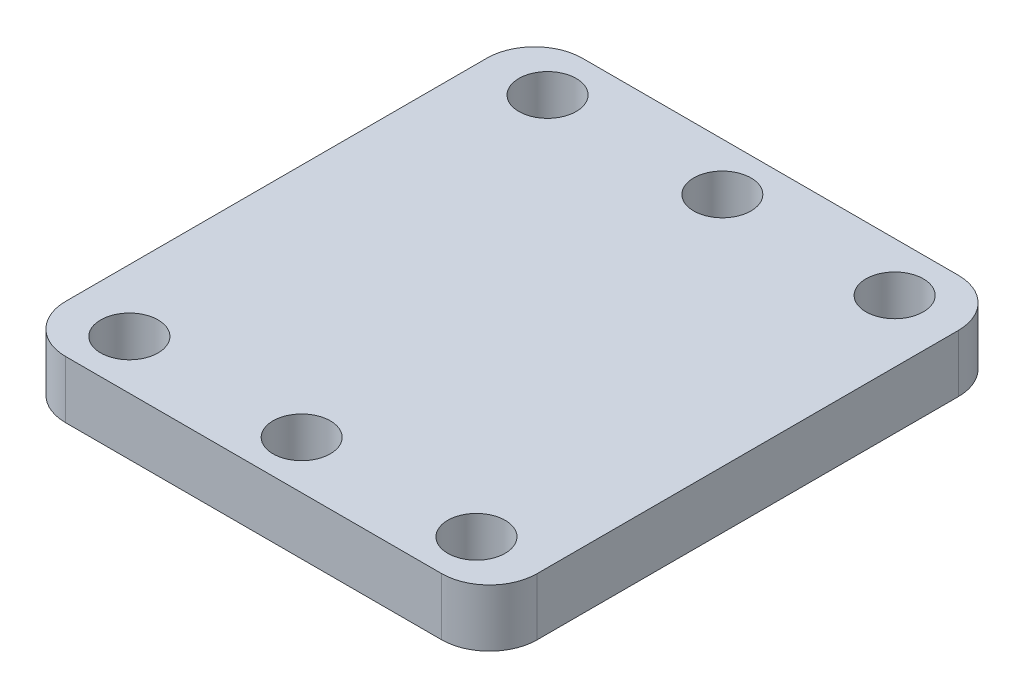
from build123d import *

# Parameters (mm, degrees)
CROQUIS1_R              = 1.498200291
CROQUIS1_R_2            = 1.5
SALIENTE_EXTRUIR1_DEPTH = 1.5


with BuildPart() as part:
    # Croquis1 → Saliente-Extruir1 (new, symmetric)
    with BuildSketch(Plane(origin=(0, 0, 0), x_dir=(1, 0, 0), z_dir=(0, 1, 0))):
        with BuildLine():
            Line((-7.044335514, 8.976515941), (12.614040425, 8.976515941))
            ThreePointArc((12.614040425, 8.976515941), (14.381807378, 8.244282894), (15.114040425, 6.476515941))
            Line((15.114040425, 6.476515941), (15.114040425, -15.544827048))
            ThreePointArc((15.114040425, -15.544827048), (14.381807378, -17.312594001), (12.614040425, -18.044827048))
            Line((12.614040425, -18.044827048), (-7.044335514, -18.044827048))
            ThreePointArc((-7.044335514, -18.044827048), (-8.812102467, -17.312594001), (-9.544335514, -15.544827048))
            Line((-9.544335514, -15.544827048), (-9.544335514, 6.476515941))
            ThreePointArc((-9.544335514, 6.476515941), (-8.812102467, 8.244282894), (-7.044335514, 8.976515941))
        make_face()
        with Locations(Location((2.784852456, 6.465844447, 0), (0, 0, 270))):
            Circle(CROQUIS1_R, mode=Mode.SUBTRACT)
        with Locations(Location((2.784852456, -15.534155553, 0), (0, 0, 90))):
            Circle(CROQUIS1_R, mode=Mode.SUBTRACT)
        with Locations(Location((-6.290312273, 6.400402587, 0), (0, 0, 270))):
            Circle(CROQUIS1_R_2, mode=Mode.SUBTRACT)
        with Locations(Location((-6.290312273, -15.468713694, 0), (0, 0, 90))):
            Circle(CROQUIS1_R_2, mode=Mode.SUBTRACT)
        with Locations(Location((11.860017184, -15.468713694, 0), (0, 0, 270))):
            Circle(CROQUIS1_R_2, mode=Mode.SUBTRACT)
        with Locations(Location((11.860017184, 6.400402587, 0), (0, 0, 90))):
            Circle(CROQUIS1_R_2, mode=Mode.SUBTRACT)
    extrude(amount=SALIENTE_EXTRUIR1_DEPTH, both=True)


solid = part.part
